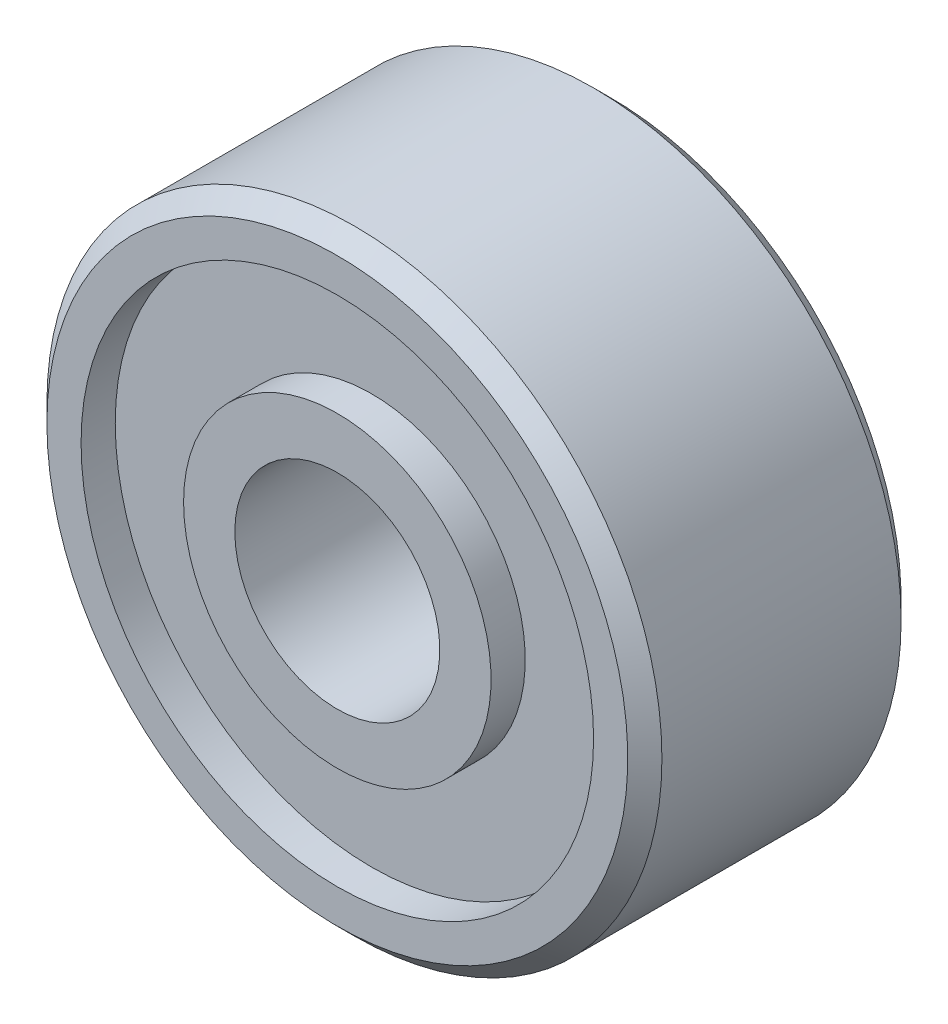
from build123d import *


with BuildPart() as part:
    # Sketch1 → Revolve1 (revolve)
    with BuildSketch(Plane.XZ, mode=Mode.PRIVATE) as revolve1_sk:
        Polygon((4.5, 1.25), (4.25, 1.5), (3.75, 1.5), (3.75, 1), (2.25, 1), (2.25, 1.5), (1.5, 1.5), (1.5, -2.5), (2.25, -2.5), (2.25, -2), (3.75, -2), (3.75, -2.5), (4.25, -2.5), (4.5, -2.25), align=None)
    revolve(revolve1_sk.sketch.rotate(Axis((0, 0, 2.5), (0, 0, -1)), 180), axis=Axis((0, 0, 2.5), (0, 0, -1)))


solid = part.part
